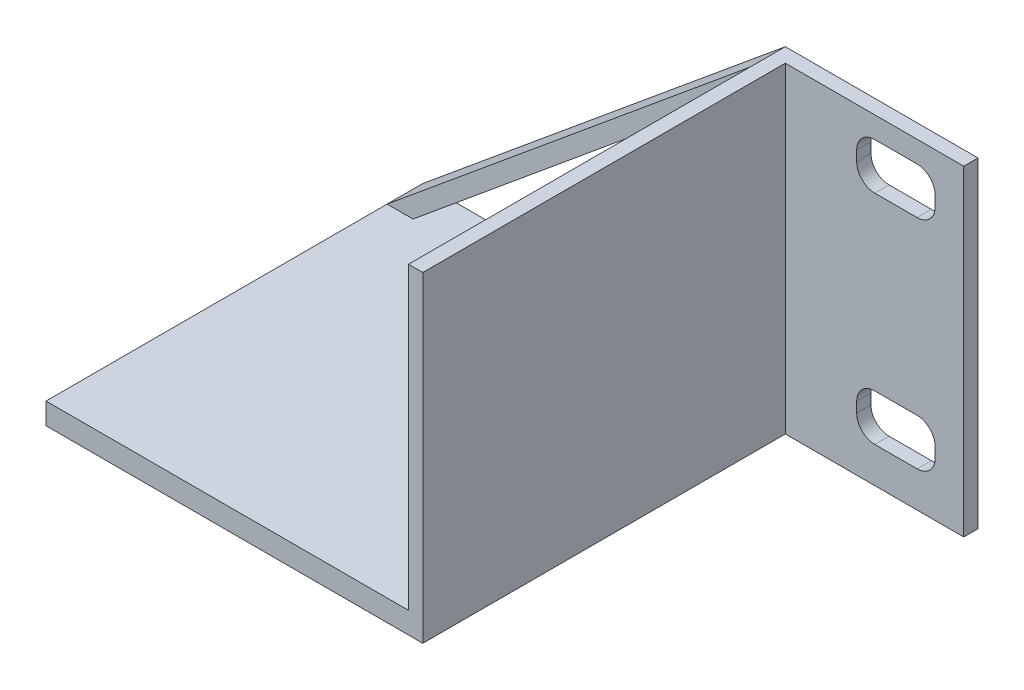
from build123d import *

# Parameters (mm, degrees)
SKETCH1_W           = 25
SKETCH1_H           = 45
BOSS_EXTRUDE1_DEPTH = 2
SKETCH2_W           = 11
SKETCH2_H           = 6.5
CUT_EXTRUDE1_DEPTH  = 19.78
FILLET1_R           = 2.54
BOSS_EXTRUDE5_DEPTH = 2
SKETCH10_W          = 52.8
SKETCH10_H          = 3
BOSS_EXTRUDE6_DEPTH = 50.8
BOSS_EXTRUDE7_DEPTH = 5
SKETCH12_R          = 6.35
CUT_EXTRUDE4_DEPTH  = 5


with BuildPart() as part:
    # Sketch1 → Boss-Extrude1 (new body)
    with BuildSketch(Plane.XY):
        with Locations((-12.5, 22.5)):
            Rectangle(SKETCH1_W, SKETCH1_H)
    extrude(amount=BOSS_EXTRUDE1_DEPTH)

    # Sketch2 → Cut-Extrude1 (cut)
    with BuildSketch(Plane.XY.offset(2)):
        with Locations((-9.5, 8.25)):
            Rectangle(SKETCH2_W, SKETCH2_H)
        with Locations((-9.5, 38.75)):
            Rectangle(SKETCH2_W, SKETCH2_H)
    extrude(amount=-CUT_EXTRUDE1_DEPTH, mode=Mode.SUBTRACT)

    # Fillet1
    fillet1_edges = [part.edges().sort_by_distance(p)[0] for p in [
        (-15, 11.5, 1),
        (-4, 11.5, 1),
        (-4, 5, 1),
        (-15, 5, 1),
        (-15, 42, 1),
        (-4, 42, 1),
        (-4, 35.5, 1),
        (-15, 35.5, 1),
    ]]
    fillet(fillet1_edges, radius=FILLET1_R)

    # Sketch9 → Boss-Extrude5 (add)
    with BuildSketch(Plane.ZY.offset(25)):
        Polygon((0, 45), (2, 45), (52.8, 45), (52.8, 0), (2, 0), (0, 0), align=None)
    extrude(amount=BOSS_EXTRUDE5_DEPTH)

    # Sketch10 → Boss-Extrude6 (add)
    with BuildSketch(Plane.ZY.offset(27)):
        with Locations((26.4, 1.5)):
            Rectangle(SKETCH10_W, SKETCH10_H)
    extrude(amount=BOSS_EXTRUDE6_DEPTH)

    # Sketch11 → Boss-Extrude7 (add)
    with BuildSketch(Plane(origin=(0, 0, 0), x_dir=(-1, 0, 0), z_dir=(0, 0, -1))):
        Polygon((27, 45), (77.8, 3), (77.8, 0), (27, 42), align=None)
    extrude(amount=-BOSS_EXTRUDE7_DEPTH)

    # Sketch12 → Cut-Extrude4 (cut)
    with BuildSketch(Plane(origin=(0, 3, 0), x_dir=(1, 0, 0), z_dir=(0, 1, 0))):
        with Locations(Location((-39.7, -17.7, 0), (0, 0, 270))):
            Circle(SKETCH12_R)
    extrude(amount=-CUT_EXTRUDE4_DEPTH, mode=Mode.SUBTRACT)


solid = part.part
